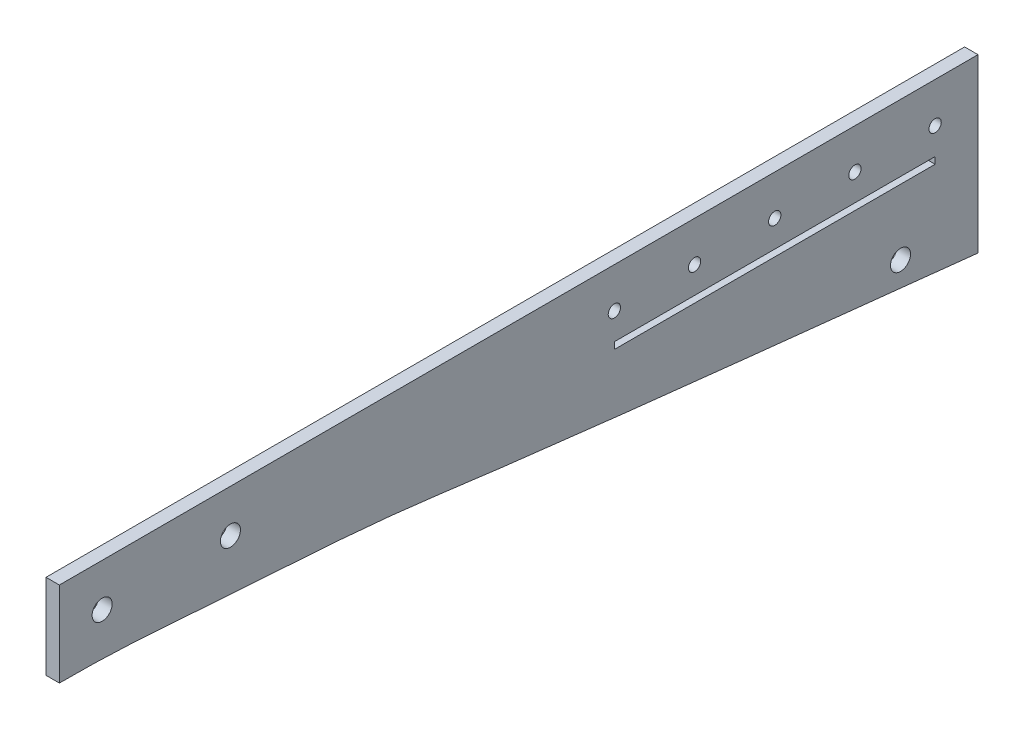
from build123d import *

# Parameters (mm, degrees)
SKETCH1_R           = 1.4605
SKETCH1_R_2         = 2.38125
SKETCH1_W           = 76.2
SKETCH1_H           = 1.5875
BOSS_EXTRUDE1_DEPTH = 3.175


with BuildPart() as part:
    # Sketch1 → Boss-Extrude1 (new body)
    with BuildSketch(Plane(origin=(0, 0, -187.325), x_dir=(0, 0, 1), z_dir=(-1, 0, 0))):
        with BuildLine():
            Line((104.70984031, 63.5), (-113.533003978, 63.5))
            Line((-113.533003978, 63.5), (-113.533003978, 22.683614274))
            add(Edge.make_bspline(
                [(104.70984031, 43.322928246), (97.292428523, 43.369222767), (86.485562122, 42.947747635), (59.066875535, 40.734135472), (33.287431115, 39.5878223), (-16.446460986, 32.848239562), (-71.701017552, 27.184558545), (-112.180029797, 22.829441378), (-113.533003978, 22.683614274)],
                knots=[0.290535466, 0.290535466, 0.290535466, 0.290535466, 0.346598052, 0.372016829, 0.495604882, 0.537891493, 0.752596324, 0.760056632, 0.760056632, 0.760056632, 0.760056632], degree=3))
            Line((104.70984031, 43.322928246), (104.70984031, 63.5))
        make_face()
        with Locations(Location((-84.295733083, 53.975, 0), (0, 0, 270))):
            Circle(SKETCH1_R, mode=Mode.SUBTRACT)
        with Locations(Location((-46.195733083, 53.975, 0), (0, 0, 270))):
            Circle(SKETCH1_R, mode=Mode.SUBTRACT)
        with Locations(Location((-27.145733083, 53.975, 0), (0, 0, 270))):
            Circle(SKETCH1_R, mode=Mode.SUBTRACT)
        with Locations(Location((64.06984031, 53.34, 0), (0, 0, 270))):
            Circle(SKETCH1_R_2, mode=Mode.SUBTRACT)
        with Locations(Location((94.54984031, 53.34, 0), (0, 0, 270))):
            Circle(SKETCH1_R_2, mode=Mode.SUBTRACT)
        with Locations(Location((-103.345733083, 53.975, 0), (0, 0, 270))):
            Circle(SKETCH1_R, mode=Mode.SUBTRACT)
        with Locations(Location((-95.118003978, 30.48, 0), (0, 0, 270))):
            Circle(SKETCH1_R_2, mode=Mode.SUBTRACT)
        with Locations(Location((-65.245733083, 53.975, 0), (0, 0, 270))):
            Circle(SKETCH1_R, mode=Mode.SUBTRACT)
        with Locations((-65.245733083, 46.83125)):
            Rectangle(SKETCH1_W, SKETCH1_H, mode=Mode.SUBTRACT)
    extrude(amount=BOSS_EXTRUDE1_DEPTH)


solid = part.part
